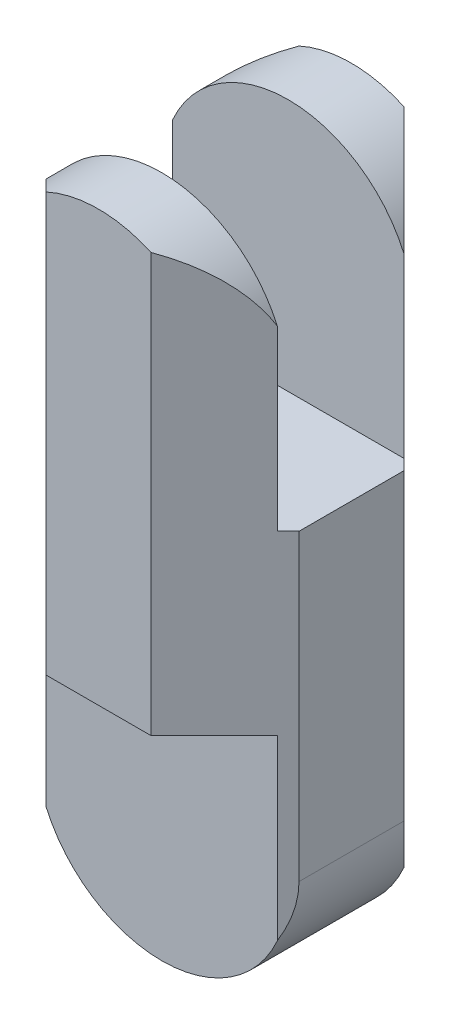
from build123d import *

# Parameters (mm, degrees)
EXTRUDE_1_DEPTH     = 54
CUT_EXTRUDE_1_DEPTH = 66
CUT_EXTRUDE_2_DEPTH = 5
CUT_EXTRUDE_START   = -5
CUT_EXTRUDE_3_DEPTH = 5
SKETCH_6_W          = 20
SKETCH_6_H          = 20
CUT_EXTRUDE_4_DEPTH = 5
CUT_EXTRUDE_5_DEPTH = 30


with BuildPart() as part:
    # 草图1 → 凸台-拉伸1 (new body)
    with BuildSketch(Plane(origin=(0, 0, 0), x_dir=(1, 0, 0), z_dir=(0, 1, 0))):
        Polygon((10, 4.142135624), (4.142135624, 10), (-4.142135624, 10), (-10, 4.142135624), (-10, -4.142135624), (-4.142135624, -10), (4.142135624, -10), (10, -4.142135624), align=None)
    extrude(amount=EXTRUDE_1_DEPTH)

    # 草图2 → 切除-拉伸1 (cut)
    with BuildSketch(Plane.XY.offset(10)):
        with BuildLine():
            Line((-10, 10), (-10, -2.389295552))
            Line((-10, -2.389295552), (10, -2.389295552))
            Line((10, -2.389295552), (10, 10))
            ThreePointArc((10, 10), (0, 0), (-10, 10))
        make_face()
    extrude(amount=-CUT_EXTRUDE_1_DEPTH, mode=Mode.SUBTRACT)

    # 草图4 → 切除-拉伸2 (cut)
    with BuildSketch(Plane.XY.offset(10)):
        with BuildLine():
            Line((-10, 10), (-10, 20))
            Line((-10, 20), (10, 20))
            Line((10, 20), (10, 10))
            ThreePointArc((10, 10), (0, 0), (-10, 10))
        make_face()
    extrude(amount=-CUT_EXTRUDE_2_DEPTH, mode=Mode.SUBTRACT)

    # 草图5 → 切除-拉伸3 (cut)
    with BuildSketch(Plane(origin=(0, 0, -10), x_dir=(-1, 0, 0), z_dir=(0, 0, -1)).offset(CUT_EXTRUDE_START)):
        with BuildLine():
            Line((-10, 10), (-10, 20))
            Line((-10, 20), (10, 20))
            Line((10, 20), (10, 10))
            ThreePointArc((10, 10), (0, 0), (-10, 10))
        make_face()
    extrude(amount=CUT_EXTRUDE_3_DEPTH, mode=Mode.SUBTRACT)

    # 草图6 → 切除-拉伸4 (cut, symmetric)
    with BuildSketch(Plane.XY):
        with Locations((0, 44)):
            Rectangle(SKETCH_6_W, SKETCH_6_H)
    extrude(amount=CUT_EXTRUDE_4_DEPTH, both=True, mode=Mode.SUBTRACT)

    # 草图7 → 切除-拉伸5 (cut)
    with BuildSketch(Plane.XY.offset(10)):
        with BuildLine():
            Line((-10, 44), (-10, 63.661192365))
            Line((-10, 63.661192365), (10, 63.661192365))
            Line((10, 63.661192365), (10, 44))
            ThreePointArc((10, 44), (0, 54), (-10, 44))
        make_face()
    extrude(amount=-CUT_EXTRUDE_5_DEPTH, mode=Mode.SUBTRACT)


solid = part.part
